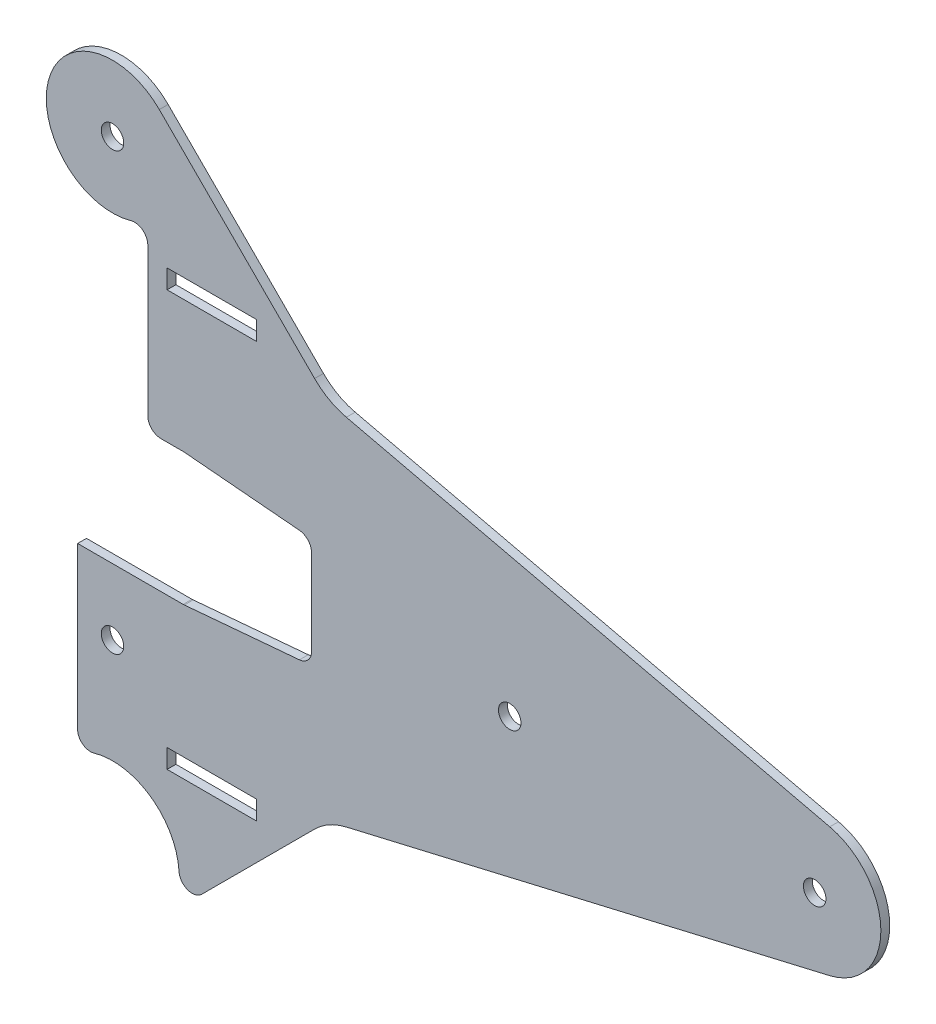
from build123d import *

# Parameters (mm, degrees)
SKETCH1_R           = 2.55
SKETCH1_W           = 20.2
SKETCH1_H           = 4.3
BOSS_EXTRUDE1_DEPTH = 2


with BuildPart() as part:
    # Sketch1 → Boss-Extrude1 (new body)
    with BuildSketch(Plane.XY):
        with BuildLine():
            Line((10.606601718, 79.393398282), (45.794858405, 44.205141595))
            ThreePointArc((45.794858405, 44.205141595), (49.111477563, 41.702351478), (52.987446424, 40.205425828))
            Line((52.987446424, 40.205425828), (162.509181482, 14.606317485))
            ThreePointArc((162.509181482, 14.606317485), (174.095167783, 0), (162.509181482, -14.606317485))
            Line((162.509181482, -14.606317485), (52.987446424, -40.205425828))
            ThreePointArc((52.987446424, -40.205425828), (49.111477563, -41.702351478), (45.794858405, -44.205141595))
            Line((45.794858405, -44.205141595), (45, -45))
            Line((45, -45), (20.188094295, -69.811905705))
            ThreePointArc((20.188094295, -69.811905705), (17.003220161, -70.495733011), (15.072281031, -67.872277826))
            ThreePointArc((15.072281031, -67.872277826), (8.704147834, -56.447922609), (-4.194444444, -54.28105164))
            ThreePointArc((-4.194444444, -54.28105164), (-6.742683116, -53.813165335), (-7.9, -51.495180099))
            Line((-7.9, -51.495180099), (-7.9, -15))
            Line((-7.9, -15), (16.016224064, -15))
            ThreePointArc((16.016224064, -15), (16.147099086, -14.997143929), (16.277724915, -14.988581152))
            Line((16.277724915, -14.988581152), (42.361500851, -12.706250758))
            ThreePointArc((42.361500851, -12.706250758), (44.311843411, -11.744427787), (45.1, -9.717669606))
            Line((45.1, -9.717669606), (45.1, 9.717669606))
            ThreePointArc((45.1, 9.717669606), (44.311843411, 11.744427787), (42.361500851, 12.706250758))
            Line((42.361500851, 12.706250758), (16.277724915, 14.988581152))
            ThreePointArc((16.277724915, 14.988581152), (16.147099086, 14.997143929), (16.016224064, 15))
            Line((16.016224064, 15), (11, 15))
            ThreePointArc((11, 15), (8.878679656, 15.878679656), (8, 18))
            Line((8, 18), (8, 51.495180099))
            ThreePointArc((8, 51.495180099), (6.802775638, 53.89309586), (4.166666667, 54.377116176))
            ThreePointArc((4.166666667, 54.377116176), (-9.013878189, 56.797217756), (-15, 68.786796564))
            ThreePointArc((-15, 68.786796564), (-5.740251485, 82.644989552), (10.606601718, 79.393398282))
        make_face()
        with Locations((159.095167783, 0)):
            Circle(SKETCH1_R, mode=Mode.SUBTRACT)
        with Locations((90, 0)):
            Circle(SKETCH1_R, mode=Mode.SUBTRACT)
        with Locations((0, 68.786796564)):
            Circle(SKETCH1_R, mode=Mode.SUBTRACT)
        with Locations((0, -30)):
            Circle(SKETCH1_R, mode=Mode.SUBTRACT)
        with Locations((22.474619372, 47.05)):
            Rectangle(SKETCH1_W, SKETCH1_H, mode=Mode.SUBTRACT)
        with Locations((22.474619372, -47.05)):
            Rectangle(SKETCH1_W, SKETCH1_H, mode=Mode.SUBTRACT)
    extrude(amount=BOSS_EXTRUDE1_DEPTH)


solid = part.part
